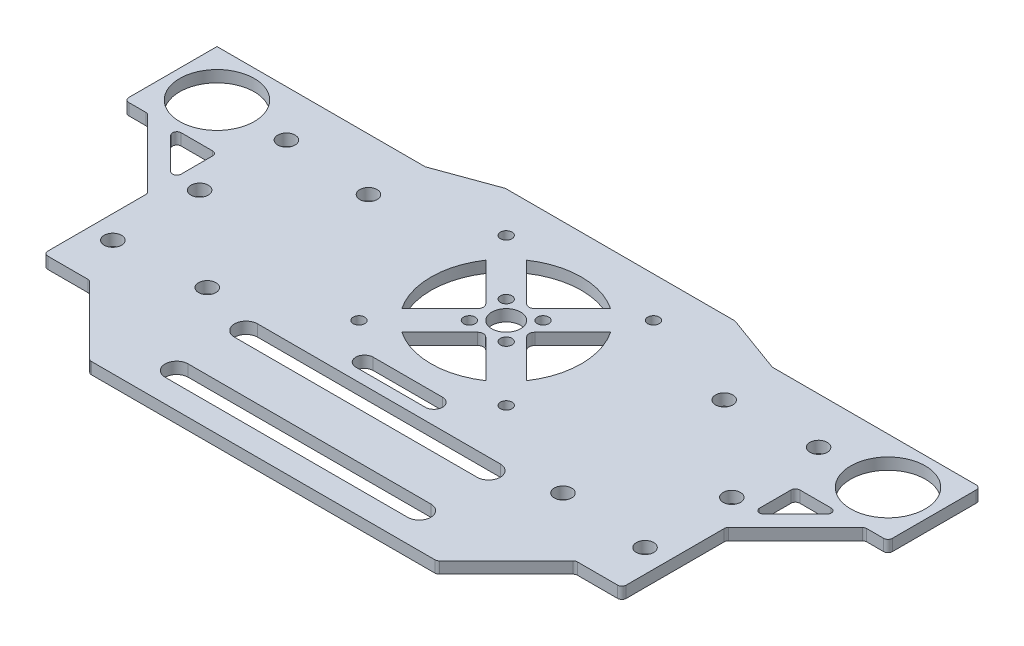
from build123d import *

# Parameters (mm, degrees)
SKETCH_1_R      = 1.5
SKETCH_1_R_2    = 1
SKETCH_1_R_3    = 15
SKETCH_1_R_4    = 2.5
SKETCH_1_R_5    = 6.45
EXTRUDE_1_DEPTH = 2
FILLET_1_R      = 0.75


with BuildPart() as part:
    # 草图1 → 凸台-拉伸1 (new body)
    # profile 1 of 11: a face of its own
    with BuildSketch(Plane(origin=(0, 0, 0), x_dir=(1, 0, 0), z_dir=(0, 1, 0))):
        Polygon((-19.848034865, 26.695013128), (-30, 23), (30, 23), (19.848034865, 26.695013128), (0.026493373, 26.695013128), (-0.026493373, 26.695013128), align=None)
    # profile 2 of 11: a face of its own
    with BuildSketch(Plane(origin=(0, 0, 0), x_dir=(1, 0, 0), z_dir=(0, 1, 0))):
        Polygon((-19.848034865, 26.695013128), (-30, 23), (30, 23), (19.848034865, 26.695013128), (0.026493373, 26.695013128), (-0.026493373, 26.695013128), align=None)
    # profile 3 of 11: a face of its own
    with BuildSketch(Plane(origin=(0, 0, 0), x_dir=(1, 0, 0), z_dir=(0, 1, 0))):
        Polygon((-30, 23), (-50, 23), (-50, 7), (-50, -1), (-50, -5), (-50, -23), (-42, -23), (42, -23), (50, -23), (50, -5), (50, -1), (50, 7), (50, 23), (30, 23), align=None)
        with Locations(Location((-46, -15, 0), (0, 0, 270))):
            Circle(SKETCH_1_R, mode=Mode.SUBTRACT)
        with Locations(Location((-30.7465, -13.935, 0), (0, 0, 270))):
            Circle(SKETCH_1_R, mode=Mode.SUBTRACT)
        with Locations(Location((-12.727922061, -5.727922061, 0), (0, 0, 270))):
            Circle(SKETCH_1_R_2, mode=Mode.SUBTRACT)
        with BuildLine():
            ThreePointArc((-20.969611628, -19), (-22.969611628, -17), (-20.969611628, -15))
            Line((-20.969611628, -15), (20.969611628, -15))
            ThreePointArc((20.969611628, -15), (22.969611628, -17), (20.969611628, -19))
            Line((20.969611628, -19), (-20.969611628, -19))
        make_face(mode=Mode.SUBTRACT)
        with Locations(Location((30.7465, -13.935, 0), (0, 0, 270))):
            Circle(SKETCH_1_R, mode=Mode.SUBTRACT)
        with BuildLine():
            ThreePointArc((-6, -13), (-7.5, -11.5), (-6, -10))
            Line((-6, -10), (6, -10))
            ThreePointArc((6, -10), (7.5, -11.5), (6, -13))
            Line((6, -13), (-6, -13))
        make_face(mode=Mode.SUBTRACT)
        with Locations(Location((12.727922061, -5.727922061, 0), (0, 0, 270))):
            Circle(SKETCH_1_R_2, mode=Mode.SUBTRACT)
        with Locations(Location((46, -15, 0), (0, 0, 270))):
            Circle(SKETCH_1_R, mode=Mode.SUBTRACT)
        with Locations(Location((-46, 0, 0), (0, 0, 270))):
            Circle(SKETCH_1_R, mode=Mode.SUBTRACT)
        with Locations(Location((-46, 15, 0), (0, 0, 270))):
            Circle(SKETCH_1_R, mode=Mode.SUBTRACT)
        with Locations(Location((-30.7465, 13.935, 0), (0, 0, 270))):
            Circle(SKETCH_1_R, mode=Mode.SUBTRACT)
        with Locations(Location((-12.727922061, 19.727922061, 0), (0, 0, 270))):
            Circle(SKETCH_1_R_2, mode=Mode.SUBTRACT)
        with Locations((0, 7)):
            Circle(SKETCH_1_R_3, mode=Mode.SUBTRACT)
        with Locations(Location((46, 0, 0), (0, 0, 270))):
            Circle(SKETCH_1_R, mode=Mode.SUBTRACT)
        with Locations(Location((30.7465, 13.935, 0), (0, 0, 270))):
            Circle(SKETCH_1_R, mode=Mode.SUBTRACT)
        with Locations(Location((12.727922061, 19.727922061, 0), (0, 0, 270))):
            Circle(SKETCH_1_R_2, mode=Mode.SUBTRACT)
        with Locations(Location((46, 15, 0), (0, 0, 270))):
            Circle(SKETCH_1_R, mode=Mode.SUBTRACT)
    # profile 4 of 11: a face of its own
    with BuildSketch(Plane(origin=(0, 0, 0), x_dir=(1, 0, 0), z_dir=(0, 1, 0))):
        Polygon((-30, 23), (-50, 23), (-50, 7), (-50, -1), (-50, -5), (-50, -23), (-42, -23), (42, -23), (50, -23), (50, -5), (50, -1), (50, 7), (50, 23), (30, 23), align=None)
        with Locations(Location((-46, -15, 0), (0, 0, 270))):
            Circle(SKETCH_1_R, mode=Mode.SUBTRACT)
        with Locations(Location((-30.7465, -13.935, 0), (0, 0, 270))):
            Circle(SKETCH_1_R, mode=Mode.SUBTRACT)
        with Locations(Location((-12.727922061, -5.727922061, 0), (0, 0, 270))):
            Circle(SKETCH_1_R_2, mode=Mode.SUBTRACT)
        with BuildLine():
            ThreePointArc((-20.969611628, -19), (-22.969611628, -17), (-20.969611628, -15))
            Line((-20.969611628, -15), (20.969611628, -15))
            ThreePointArc((20.969611628, -15), (22.969611628, -17), (20.969611628, -19))
            Line((20.969611628, -19), (-20.969611628, -19))
        make_face(mode=Mode.SUBTRACT)
        with Locations(Location((30.7465, -13.935, 0), (0, 0, 270))):
            Circle(SKETCH_1_R, mode=Mode.SUBTRACT)
        with BuildLine():
            ThreePointArc((-6, -13), (-7.5, -11.5), (-6, -10))
            Line((-6, -10), (6, -10))
            ThreePointArc((6, -10), (7.5, -11.5), (6, -13))
            Line((6, -13), (-6, -13))
        make_face(mode=Mode.SUBTRACT)
        with Locations(Location((12.727922061, -5.727922061, 0), (0, 0, 270))):
            Circle(SKETCH_1_R_2, mode=Mode.SUBTRACT)
        with Locations(Location((46, -15, 0), (0, 0, 270))):
            Circle(SKETCH_1_R, mode=Mode.SUBTRACT)
        with Locations(Location((-46, 0, 0), (0, 0, 270))):
            Circle(SKETCH_1_R, mode=Mode.SUBTRACT)
        with Locations(Location((-46, 15, 0), (0, 0, 270))):
            Circle(SKETCH_1_R, mode=Mode.SUBTRACT)
        with Locations(Location((-30.7465, 13.935, 0), (0, 0, 270))):
            Circle(SKETCH_1_R, mode=Mode.SUBTRACT)
        with Locations(Location((-12.727922061, 19.727922061, 0), (0, 0, 270))):
            Circle(SKETCH_1_R_2, mode=Mode.SUBTRACT)
        with Locations((0, 7)):
            Circle(SKETCH_1_R_3, mode=Mode.SUBTRACT)
        with Locations(Location((46, 0, 0), (0, 0, 270))):
            Circle(SKETCH_1_R, mode=Mode.SUBTRACT)
        with Locations(Location((30.7465, 13.935, 0), (0, 0, 270))):
            Circle(SKETCH_1_R, mode=Mode.SUBTRACT)
        with Locations(Location((12.727922061, 19.727922061, 0), (0, 0, 270))):
            Circle(SKETCH_1_R_2, mode=Mode.SUBTRACT)
        with Locations(Location((46, 15, 0), (0, 0, 270))):
            Circle(SKETCH_1_R, mode=Mode.SUBTRACT)
    # profile 5 of 11: a face of its own
    with BuildSketch(Plane(origin=(0, 0, 0), x_dir=(1, 0, 0), z_dir=(0, 1, 0))):
        with Locations((0, 7)):
            Circle(SKETCH_1_R_3)
        with BuildLine():
            ThreePointArc((13, 7), (12.434860091, 3.208660592), (10.788576229, -0.253042323))
            ThreePointArc((10.788576229, -0.253042323), (9.192388155, -2.192388155), (7.253042323, -3.788576229))
            ThreePointArc((7.253042323, -3.788576229), (0, -6), (-7.253042323, -3.788576229))
            ThreePointArc((-7.253042323, -3.788576229), (-9.192388155, -2.192388155), (-10.788576229, -0.253042323))
            ThreePointArc((-10.788576229, -0.253042323), (-13, 7), (-10.788576229, 14.253042323))
            ThreePointArc((-10.788576229, 14.253042323), (-9.192388155, 16.192388155), (-7.253042323, 17.788576229))
            ThreePointArc((-7.253042323, 17.788576229), (0, 20), (7.253042323, 17.788576229))
            ThreePointArc((7.253042323, 17.788576229), (9.192388155, 16.192388155), (10.788576229, 14.253042323))
            ThreePointArc((10.788576229, 14.253042323), (12.434860091, 10.791339408), (13, 7))
        make_face(mode=Mode.SUBTRACT)
    # profile 6 of 11: a face of its own
    with BuildSketch(Plane(origin=(0, 0, 0), x_dir=(1, 0, 0), z_dir=(0, 1, 0))):
        with BuildLine():
            ThreePointArc((7.253042323, -3.788576229), (9.192388155, -2.192388155), (10.788576229, -0.253042323))
            Line((10.788576229, -0.253042323), (4.242640687, 6.292893219))
            ThreePointArc((4.242640687, 6.292893219), (3.949747468, 7), (4.242640687, 7.707106781))
            Line((4.242640687, 7.707106781), (10.788576229, 14.253042323))
            ThreePointArc((10.788576229, 14.253042323), (9.192388155, 16.192388155), (7.253042323, 17.788576229))
            Line((7.253042323, 17.788576229), (0.707106781, 11.242640687))
            ThreePointArc((0.707106781, 11.242640687), (0, 10.949747468), (-0.707106781, 11.242640687))
            Line((-0.707106781, 11.242640687), (-7.253042323, 17.788576229))
            ThreePointArc((-7.253042323, 17.788576229), (-9.192388155, 16.192388155), (-10.788576229, 14.253042323))
            Line((-10.788576229, 14.253042323), (-4.242640687, 7.707106781))
            ThreePointArc((-4.242640687, 7.707106781), (-3.949747468, 7), (-4.242640687, 6.292893219))
            Line((-4.242640687, 6.292893219), (-10.788576229, -0.253042323))
            ThreePointArc((-10.788576229, -0.253042323), (-9.192388155, -2.192388155), (-7.253042323, -3.788576229))
            Line((-7.253042323, -3.788576229), (-0.707106781, 2.757359313))
            ThreePointArc((-0.707106781, 2.757359313), (0, 3.050252532), (0.707106781, 2.757359313))
            Line((0.707106781, 2.757359313), (7.253042323, -3.788576229))
        make_face()
        with Locations(Location((-3.181980515, 3.818019485, 0), (0, 0, 270))):
            Circle(SKETCH_1_R_2, mode=Mode.SUBTRACT)
        with Locations(Location((-3.181980515, 10.181980515, 0), (0, 0, 270))):
            Circle(SKETCH_1_R_2, mode=Mode.SUBTRACT)
        with Locations(Location((3.181980515, 3.818019485, 0), (0, 0, 270))):
            Circle(SKETCH_1_R_2, mode=Mode.SUBTRACT)
        with Locations(Location((0, 7, 0), (0, 0, 270))):
            Circle(SKETCH_1_R_4, mode=Mode.SUBTRACT)
        with Locations(Location((3.181980515, 10.181980515, 0), (0, 0, 270))):
            Circle(SKETCH_1_R_2, mode=Mode.SUBTRACT)
    # profile 7 of 11: a face of its own
    with BuildSketch(Plane(origin=(0, 0, 0), x_dir=(1, 0, 0), z_dir=(0, 1, 0))):
        Polygon((42, -23), (-42, -23), (-30, -35), (30, -35), align=None)
        with BuildLine():
            ThreePointArc((-20.969611628, -31), (-22.969611628, -29), (-20.969611628, -27))
            Line((-20.969611628, -27), (20.969611628, -27))
            ThreePointArc((20.969611628, -27), (22.969611628, -29), (20.969611628, -31))
            Line((20.969611628, -31), (-20.969611628, -31))
        make_face(mode=Mode.SUBTRACT)
    # profile 8 of 11: a face of its own
    with BuildSketch(Plane(origin=(0, 0, 0), x_dir=(1, 0, 0), z_dir=(0, 1, 0))):
        Polygon((-50, -5), (-50, -1), (-58, 7), (-62, 7), align=None)
    # profile 9 of 11: a face of its own
    with BuildSketch(Plane(origin=(0, 0, 0), x_dir=(1, 0, 0), z_dir=(0, 1, 0))):
        Polygon((-50, 7), (-50, 23), (-66, 23), (-66, 7), (-62, 7), (-58, 7), align=None)
        with Locations(Location((-58, 15, 0), (0, 0, 270))):
            Circle(SKETCH_1_R_5, mode=Mode.SUBTRACT)
    # profile 10 of 11: a face of its own
    with BuildSketch(Plane(origin=(0, 0, 0), x_dir=(1, 0, 0), z_dir=(0, 1, 0))):
        Polygon((66, 23), (50, 23), (50, 7), (58, 7), (62, 7), (66, 7), align=None)
        with Locations(Location((58, 15, 0), (0, 0, 270))):
            Circle(SKETCH_1_R_5, mode=Mode.SUBTRACT)
    # profile 11 of 11: a face of its own
    with BuildSketch(Plane(origin=(0, 0, 0), x_dir=(1, 0, 0), z_dir=(0, 1, 0))):
        Polygon((58, 7), (50, -1), (50, -5), (62, 7), align=None)
    extrude(amount=EXTRUDE_1_DEPTH)

    # 圆角1
    fillet_1_edges = [part.edges().sort_by_distance(p)[0] for p in [
        (66, 1, -23),
        (66, 1, -7),
        (62, 1, -7),
        (50, 1, 5),
        (50, 1, 23),
        (42, 1, 23),
        (30, 1, 35),
        (-30, 1, 35),
        (-42, 1, 23),
        (-50, 1, 23),
        (-50, 1, 5),
        (-62, 1, -7),
        (-66, 1, -7),
        (50, 1, -7),
        (50, 1, 1),
        (58, 1, -7),
        (-50, 1, 1),
        (-50, 1, -7),
        (-58, 1, -7),
    ]]
    fillet(fillet_1_edges, radius=FILLET_1_R)


solid = part.part
